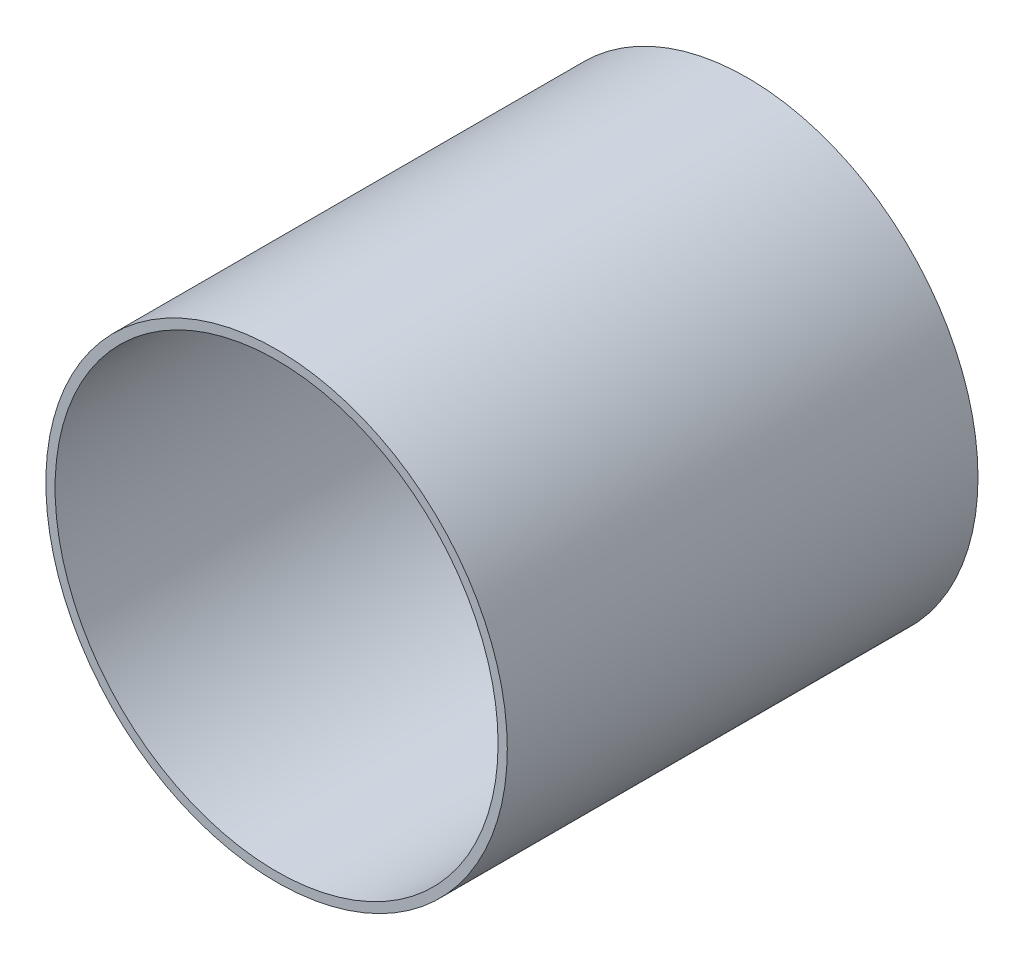
from build123d import *

# Parameters (mm, degrees)
SKETCH1_R           = 75
BOSS_EXTRUDE1_DEPTH = 3
SKETCH2_R           = 75
SKETCH2_R_2         = 72
BOSS_EXTRUDE2_DEPTH = 150
SKETCH3_R           = 5
CUT_EXTRUDE1_DEPTH  = 150


with BuildPart() as part:
    # Sketch1 → Boss-Extrude1 (new body)
    with BuildSketch(Plane.XY):
        Circle(SKETCH1_R)
    extrude(amount=BOSS_EXTRUDE1_DEPTH)

    # Sketch2 → Boss-Extrude2 (add)
    with BuildSketch(Plane.XY.offset(3)):
        Circle(SKETCH2_R)
        Circle(SKETCH2_R_2, mode=Mode.SUBTRACT)
    extrude(amount=BOSS_EXTRUDE2_DEPTH)

    # Sketch3 → Cut-Extrude1 (cut)
    with BuildSketch(Plane.XY.offset(3)):
        with Locations((30, 0)):
            Circle(SKETCH3_R)
        with Locations((-30, 0)):
            Circle(SKETCH3_R)
    extrude(amount=-CUT_EXTRUDE1_DEPTH, mode=Mode.SUBTRACT)


solid = part.part
